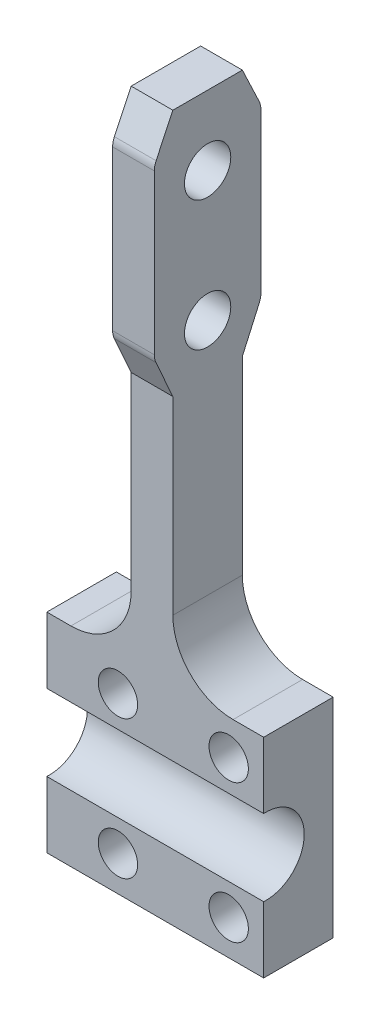
from build123d import *

# Parameters (mm, degrees)
SKETCH1_R           = 4.25
BOSS_EXTRUDE1_DEPTH = 15
SKETCH3_R           = 8.25
CUT_EXTRUDE1_DEPTH  = 55.05
SKETCH4_R           = 5
CUT_EXTRUDE3_DEPTH  = 46.05
BOSS_EXTRUDE2_DEPTH = 9
FILLET1_R           = 13


with BuildPart() as part:
    # Sketch1 → Boss-Extrude1 (new body)
    with BuildSketch(Plane.XY):
        with BuildLine():
            Line((-8.1, 22.5), (-8.1, 129.9))
            Line((-8.1, 129.9), (0.9, 129.9))
            Line((0.9, 129.9), (0.9, 35.5))
            ThreePointArc((0.9, 35.5), (4.707611845, 26.307611845), (13.9, 22.5))
            Line((13.9, 22.5), (20.5, 22.5))
            Line((20.5, 22.5), (20.5, -22.5))
            Line((20.5, -22.5), (-26.3, -22.5))
            Line((-26.3, -22.5), (-26.3, 22.5))
            Line((-26.3, 22.5), (-8.1, 22.5))
        make_face()
        with Locations((-10.95, -14.95)):
            Circle(SKETCH1_R, mode=Mode.SUBTRACT)
        with Locations((12.95, -14.95)):
            Circle(SKETCH1_R, mode=Mode.SUBTRACT)
        with Locations((12.95, 14.95)):
            Circle(SKETCH1_R, mode=Mode.SUBTRACT)
        with Locations((-10.95, 14.95)):
            Circle(SKETCH1_R, mode=Mode.SUBTRACT)
    extrude(amount=BOSS_EXTRUDE1_DEPTH)

    # Sketch3 → Cut-Extrude1 (cut)
    with BuildSketch(Plane.ZY.offset(26.3)):
        with Locations((14.5, 0)):
            Circle(SKETCH3_R)
    extrude(amount=-CUT_EXTRUDE1_DEPTH, mode=Mode.SUBTRACT)

    # Sketch4 → Cut-Extrude3 (cut)
    with BuildSketch(Plane(origin=(0.9, 0, 0), x_dir=(0, 0, -1), z_dir=(1, 0, 0))):
        with Locations((-7.5, 86.9)):
            Circle(SKETCH4_R)
        with Locations((-7.5, 114.9)):
            Circle(SKETCH4_R)
    extrude(amount=-CUT_EXTRUDE3_DEPTH, mode=Mode.SUBTRACT)

    # Sketch6 → Boss-Extrude2 (add)
    with BuildSketch(Plane.ZY.offset(8.1)):
        with BuildLine():
            Line((15, 76.386851455), (18.651630299, 84.554112306))
            ThreePointArc((18.651630299, 84.554112306), (18.911938215, 85.352068488), (19, 86.186777661))
            Line((19, 86.186777661), (19, 120.550049196))
            ThreePointArc((19, 120.550049196), (18.902685036, 121.427003874), (18.615475246, 122.261288146))
            Line((18.615475246, 122.261288146), (15, 129.9))
            Line((15, 129.9), (15, 76.386851455))
        make_face()
        with BuildLine():
            Line((-3.615475246, 122.261288146), (0, 129.9))
            Line((0, 129.9), (0, 76.386851455))
            Line((0, 76.386851455), (-3.651630299, 84.554112306))
            ThreePointArc((-3.651630299, 84.554112306), (-3.911938215, 85.352068488), (-4, 86.186777661))
            Line((-4, 86.186777661), (-4, 120.550049196))
            ThreePointArc((-4, 120.550049196), (-3.902685036, 121.427003874), (-3.615475246, 122.261288146))
        make_face()
    extrude(amount=-BOSS_EXTRUDE2_DEPTH)

    # Fillet1
    fillet1_edges = [part.edges().sort_by_distance(p)[0] for p in [
        (-8.1, 22.5, 7.5),
    ]]
    fillet(fillet1_edges, radius=FILLET1_R)


solid = part.part
